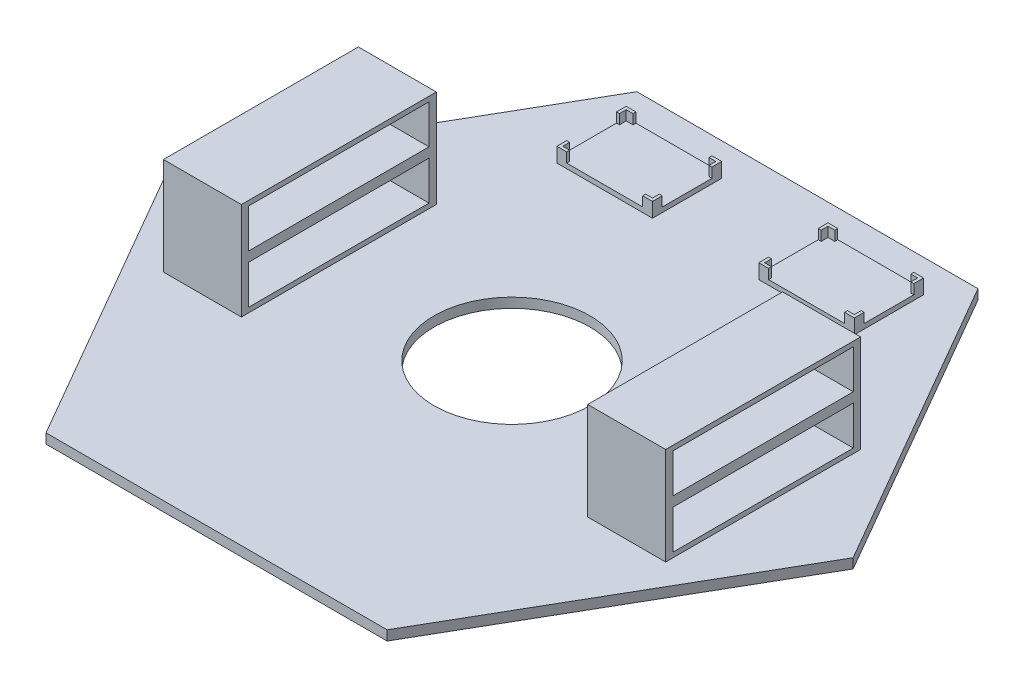
from build123d import *

# Parameters (mm, degrees)
BOSS_EXTRUDE1_DEPTH = 10
BOSS_EXTRUDE2_DEPTH = 15
SKETCH3_R           = 80
CUT_EXTRUDE1_DEPTH  = 10
SKETCH4_W           = 98
SKETCH4_H           = 71
BOSS_EXTRUDE3_DEPTH = 5
SKETCH5_W           = 80
SKETCH5_H           = 200
BOSS_EXTRUDE4_DEPTH = 100
SKETCH6_W           = 185
SKETCH6_H           = 40
CUT_EXTRUDE2_DEPTH  = 80


with BuildPart() as part:
    # Sketch1 → Boss-Extrude1 (new body)
    with BuildSketch(Plane(origin=(0, 0, 0), x_dir=(1, 0, 0), z_dir=(0, 1, 0))):
        Polygon((350, 0), (175, 303.108891325), (-175, 303.108891325), (-350, 0), (-175, -303.108891325), (175, -303.108891325), align=None)
    extrude(amount=BOSS_EXTRUDE1_DEPTH)

    # Sketch2 → Boss-Extrude2 (add)
    with BuildSketch(Plane(origin=(0, 10, 0), x_dir=(1, 0, 0), z_dir=(0, 1, 0))):
        Polygon((54.532889038, 198.679724117), (64.532889038, 198.679724117), (64.532889038, 201.679724117), (57.532889038, 201.679724117), (57.532889038, 208.679724117), (54.532889038, 208.679724117), align=None)
        Polygon((142.532889038, 201.679724117), (142.532889038, 198.679724117), (152.532889038, 198.679724117), (152.532889038, 208.679724117), (149.532889038, 208.679724117), (149.532889038, 201.679724117), align=None)
        Polygon((54.532889038, 259.679724117), (57.532889038, 259.679724117), (57.532889038, 266.679724117), (64.532889038, 266.679724117), (64.532889038, 269.679724117), (54.532889038, 269.679724117), align=None)
        Polygon((149.532889038, 259.679724117), (152.532889038, 259.679724117), (152.532889038, 269.679724117), (142.532889038, 269.679724117), (142.532889038, 266.679724117), (149.532889038, 266.679724117), align=None)
        Polygon((-64.532889038, 201.679724117), (-64.532889038, 198.679724117), (-54.532889038, 198.679724117), (-54.532889038, 208.679724117), (-57.532889038, 208.679724117), (-57.532889038, 201.679724117), align=None)
        Polygon((-142.532889038, 198.679724117), (-142.532889038, 201.679724117), (-149.532889038, 201.679724117), (-149.532889038, 208.679724117), (-152.532889038, 208.679724117), (-152.532889038, 198.679724117), align=None)
        Polygon((-152.532889038, 259.679724117), (-149.532889038, 259.679724117), (-149.532889038, 266.679724117), (-142.532889038, 266.679724117), (-142.532889038, 269.679724117), (-152.532889038, 269.679724117), align=None)
        Polygon((-57.532889038, 259.679724117), (-54.532889038, 259.679724117), (-54.532889038, 269.679724117), (-64.532889038, 269.679724117), (-64.532889038, 266.679724117), (-57.532889038, 266.679724117), align=None)
    extrude(amount=BOSS_EXTRUDE2_DEPTH)

    # Sketch3 → Cut-Extrude1 (cut)
    with BuildSketch(Plane(origin=(0, 10, 0), x_dir=(1, 0, 0), z_dir=(0, 1, 0))):
        with Locations(Location((0, 0, 0), (0, 0, 270))):
            Circle(SKETCH3_R)
    extrude(amount=-CUT_EXTRUDE1_DEPTH, mode=Mode.SUBTRACT)

    # Sketch4 → Boss-Extrude3 (add)
    with BuildSketch(Plane(origin=(0, 10, 0), x_dir=(1, 0, 0), z_dir=(0, 1, 0))):
        with Locations((-103.532889038, 234.179724117)):
            Rectangle(SKETCH4_W, SKETCH4_H)
        with Locations((103.532889038, 234.179724117)):
            Rectangle(SKETCH4_W, SKETCH4_H)
    extrude(amount=BOSS_EXTRUDE3_DEPTH)

    # Sketch5 → Boss-Extrude4 (add)
    with BuildSketch(Plane(origin=(0, 10, 0), x_dir=(1, 0, 0), z_dir=(0, 1, 0))):
        with Locations((-217.647690378, 0)):
            Rectangle(SKETCH5_W, SKETCH5_H)
    boss_extrude4 = extrude(amount=BOSS_EXTRUDE4_DEPTH)

    # Sketch6 → Cut-Extrude2 (cut)
    with BuildSketch(Plane.ZY.offset(257.647690378)):
        with Locations((0, 35)):
            Rectangle(SKETCH6_W, SKETCH6_H)
        with Locations((0, 85)):
            Rectangle(SKETCH6_W, SKETCH6_H)
    cut_extrude2 = extrude(amount=-CUT_EXTRUDE2_DEPTH, mode=Mode.SUBTRACT)

    # Mirror1: Boss-Extrude4, Cut-Extrude2 across plane
    add(boss_extrude4.mirror(Plane(origin=(0, 0, 0), x_dir=(0, 0, 1), z_dir=(1, 0, 0))))
    add(cut_extrude2.mirror(Plane(origin=(0, 0, 0), x_dir=(0, 0, 1), z_dir=(1, 0, 0))), mode=Mode.SUBTRACT)


solid = part.part
